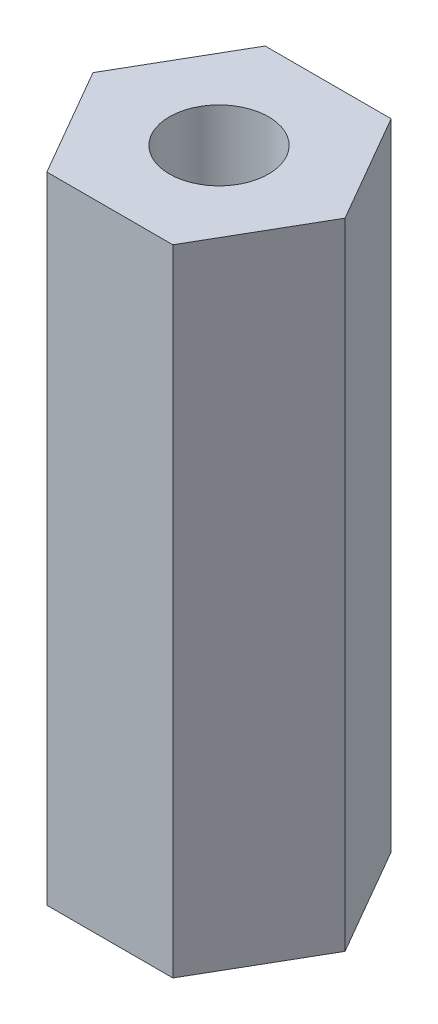
from build123d import *

# Parameters (mm, degrees)
SKETCH1_R           = 1.25
BOSS_EXTRUDE1_DEPTH = 16


with BuildPart() as part:
    # Sketch1 → Boss-Extrude1 (new body)
    with BuildSketch(Plane(origin=(0, 0, 0), x_dir=(1, 0, 0), z_dir=(0, 1, 0))):
        Polygon((3.175426481, 0), (1.58771324, 2.75), (-1.58771324, 2.75), (-3.175426481, 0), (-1.58771324, -2.75), (1.58771324, -2.75), align=None)
        with Locations(Location((0, 0, 0), (0, 0, 270))):
            Circle(SKETCH1_R, mode=Mode.SUBTRACT)
    extrude(amount=BOSS_EXTRUDE1_DEPTH)


solid = part.part
